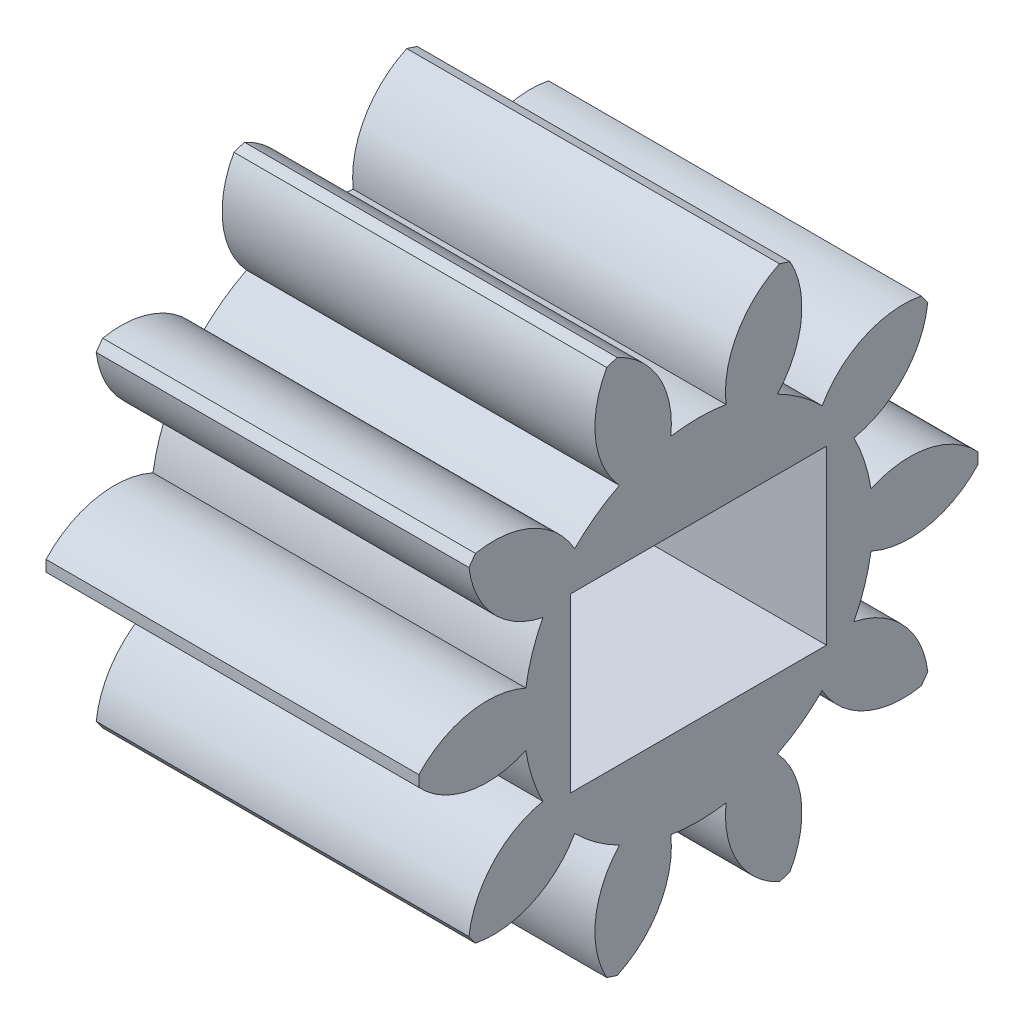
from build123d import *

# Parameters (mm, degrees)
BASPROSKE_W           = 8
BASPROSKE_H           = 6
TOOTHCUT_DEPTH        = 12.66190379
TEETHCUTS_COUNT       = 10
TEETHCUTS_ANGLE       = 324
BORSKE_R              = 0.4
BORE_DEPTH            = 50.0000508
CROQUIS1_W            = 5.5
CROQUIS1_H            = 3.7
CORTAR_EXTRUIR1_DEPTH = 6


with BuildPart() as part:
    # BasProSke → Base-Revolve (revolve)
    with BuildSketch(Plane(origin=(0, 0, 0), x_dir=(1, 0, 0), z_dir=(0, 1, 0)), mode=Mode.PRIVATE) as base_revolve_sk:
        with Locations((4, 3)):
            Rectangle(BASPROSKE_W, BASPROSKE_H)
    revolve(base_revolve_sk.sketch.rotate(Axis((-10, 0, 0), (1, 0, 0)), 180), axis=Axis((-10, 0, 0), (1, 0, 0)))

    # TooCutSke → ToothCut (cut, through all)
    with BuildSketch(Plane(origin=(0, 0, 0), x_dir=(0, 0, -1), z_dir=(1, 0, 0))):
        with BuildLine():
            ThreePointArc((0.59278292, 3.701838653), (0, 3.749), (-0.59278292, 3.701838653))
            ThreePointArc((-0.59278292, 3.701838653), (-0.846593509, 4.924114224), (-1.775771316, 5.757784417))
            ThreePointArc((-1.775771316, 5.757784417), (0, 6.0254), (1.775771316, 5.757784417))
            ThreePointArc((1.775771316, 5.757784417), (0.846593509, 4.924114224), (0.59278292, 3.701838653))
        make_face()
    toothcut = extrude(amount=TOOTHCUT_DEPTH, mode=Mode.SUBTRACT)

    # TeethCuts: ToothCut ×10 about axis
    teethcuts_axis = Axis((-10, 0, 0), (1, 0, 0))
    for i in range(1, TEETHCUTS_COUNT):
        add(toothcut.rotate(teethcuts_axis, i * TEETHCUTS_ANGLE / (TEETHCUTS_COUNT - 1)), mode=Mode.SUBTRACT)

    # BorSke → Bore (cut, symmetric)
    with BuildSketch(Plane(origin=(0, 0, 0), x_dir=(0, 0, -1), z_dir=(1, 0, 0))):
        with Locations(Location((0, 0, 0), (0, 0, 180))):
            Circle(BORSKE_R)
    extrude(amount=BORE_DEPTH, both=True, mode=Mode.SUBTRACT)

    # Croquis1 → Cortar-Extruir1 (cut)
    with BuildSketch(Plane(origin=(8, 0, 0), x_dir=(0, 0, -1), z_dir=(1, 0, 0))):
        Rectangle(CROQUIS1_W, CROQUIS1_H)
    extrude(amount=-CORTAR_EXTRUIR1_DEPTH, mode=Mode.SUBTRACT)


solid = part.part
